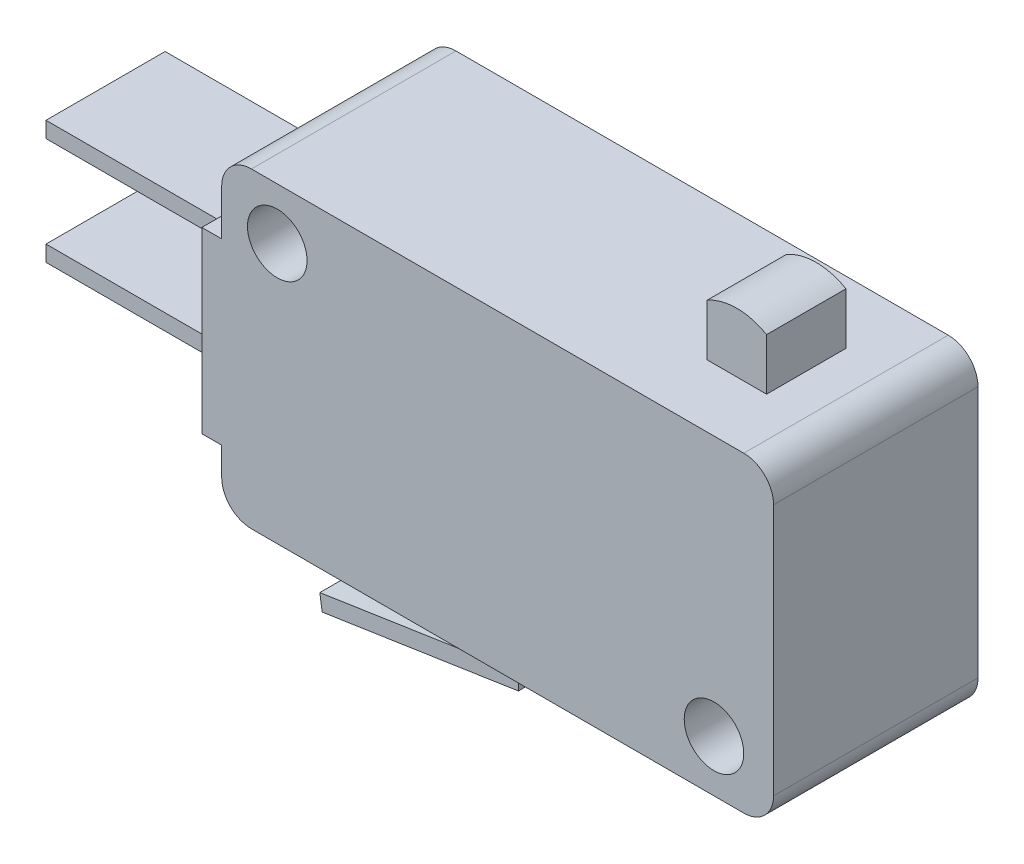
from build123d import *

# Parameters (mm, degrees)
ESQUISSE1_R          = 1.5
BOSS_EXTRU_1_DEPTH   = 5.15
ESQUISSE2_W          = 6
ESQUISSE2_H          = 0.8
BOSS_EXTRU_2_DEPTH   = 10
BOSS_EXTRU_2_2_DEPTH = 10
BOSS_EXTRU_3_DEPTH   = 6
BOSS_EXTRU_4_DEPTH   = 2
CONG_1_R             = 1.5


with BuildPart() as part:
    # Esquisse1 → Boss.-Extru.1 (new, symmetric)
    with BuildSketch(Plane.XY):
        Polygon((-27.8, -12.8), (-27.8, -15.7), (0, -15.7), (0, 0), (-27.8, 0), (-27.8, -3.8), (-28.8, -3.8), (-28.8, -12.8), align=None)
        with Locations(Location((-25, -2.6, 0), (0, 0, 180))):
            Circle(ESQUISSE1_R, mode=Mode.SUBTRACT)
        with Locations(Location((-3, -13.1, 0), (0, 0, 180))):
            Circle(ESQUISSE1_R, mode=Mode.SUBTRACT)
    extrude(amount=BOSS_EXTRU_1_DEPTH, both=True)

    # Congé1
    cong_1_edges = [part.edges().sort_by_distance(p)[0] for p in [
        (0, -15.7, 0),
        (-27.8, -15.7, 0),
        (-27.8, 0, 0),
        (0, 0, 0),
    ]]
    fillet(cong_1_edges, radius=CONG_1_R)


with BuildPart() as body_2:
    # Esquisse2 → Boss.-Extru.2 (new body)
    with BuildSketch(Plane.ZY.offset(28.8)):
        with Locations((0, -5.6)):
            Rectangle(ESQUISSE2_W, ESQUISSE2_H)
    extrude(amount=BOSS_EXTRU_2_DEPTH)


with BuildPart() as body_3:
    # Esquisse2 → Boss.-Extru.2 2 (new body)
    with BuildSketch(Plane.ZY.offset(28.8)):
        with Locations((0, -11)):
            Rectangle(ESQUISSE2_W, ESQUISSE2_H)
    extrude(amount=BOSS_EXTRU_2_2_DEPTH)


with BuildPart() as body_4:
    # Esquisse3 → Boss.-Extru.3 (new body)
    with BuildSketch(Plane.XY.offset(3)):
        Polygon((-25.006859967, -18.909051203), (-24.886859967, -19.7), (-15, -18.2), (-15, -15.7), (-15.8, -15.7), (-15.8, -17.512218437), align=None)
    extrude(amount=-BOSS_EXTRU_3_DEPTH)


with BuildPart() as body_5:
    # Esquisse4 → Boss.-Extru.4 (new, symmetric)
    with BuildSketch(Plane.XY):
        with BuildLine():
            Line((-6.5, 0), (-6.5, 2.598076211))
            ThreePointArc((-6.5, 2.598076211), (-5, 3), (-3.5, 2.598076211))
            Line((-3.5, 2.598076211), (-3.5, 0))
            Line((-3.5, 0), (-6.5, 0))
        make_face()
    extrude(amount=BOSS_EXTRU_4_DEPTH, both=True)


solid = Compound([part.part, body_2.part, body_3.part, body_4.part, body_5.part])
